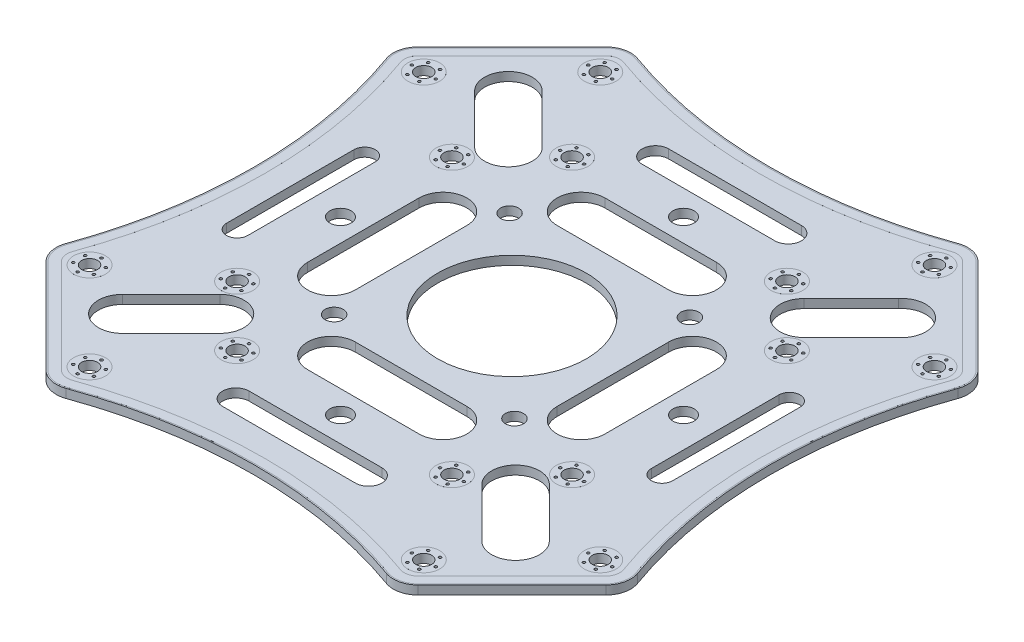
from build123d import *

# Parameters (mm, degrees)
BOSS_EXTRUDE1_DEPTH      = 0.825
BOSS_EXTRUDE1_DEPTH_BACK = 0.825
SKETCH2_R                = 14
CUT_EXTRUDE1_DEPTH       = 1.65
SKETCH3_R                = 1.5
SKETCH3_R_2              = 2
SKETCH3_R_3              = 1.7
CUT_EXTRUDE2_DEPTH       = 1.65
BOSS_EXTRUDE2_START      = 0.001
SKETCH4_R                = 3
SKETCH4_R_2              = 1.5
SKETCH4_R_3              = 0.25
BOSS_EXTRUDE2_DEPTH      = 0.001
SKETCH5_R                = 0.25
CUT_EXTRUDE3_DEPTH       = 1.65


with BuildPart() as part:
    # Sketch1 → Boss-Extrude1 (new, two sides: drawn at the far end of the back side and taken through both)
    with BuildSketch(Plane(origin=(0, 0, 0), x_dir=(1, 0, 0), z_dir=(0, 1, 0)).offset(-BOSS_EXTRUDE1_DEPTH_BACK)):
        with BuildLine():
            Line((35.046361717, 52.705589829), (52.705589829, 35.046361717))
            ThreePointArc((52.705589829, 35.046361717), (53.961944938, 32.762265708), (53.8, 30.160478519))
            ThreePointArc((53.8, 30.160478519), (48.55, 0), (53.8, -30.160478519))
            ThreePointArc((53.8, -30.160478519), (53.961944938, -32.762265708), (52.705589829, -35.046361717))
            Line((52.705589829, -35.046361717), (35.046361717, -52.705589829))
            ThreePointArc((35.046361717, -52.705589829), (32.762265708, -53.961944938), (30.160478519, -53.8))
            ThreePointArc((30.160478519, -53.8), (0, -48.55), (-30.160478519, -53.8))
            ThreePointArc((-30.160478519, -53.8), (-32.762265708, -53.961944938), (-35.046361717, -52.705589829))
            Line((-35.046361717, -52.705589829), (-52.705589829, -35.046361717))
            ThreePointArc((-52.705589829, -35.046361717), (-53.961944938, -32.762265708), (-53.8, -30.160478519))
            ThreePointArc((-53.8, -30.160478519), (-48.55, 0), (-53.8, 30.160478519))
            ThreePointArc((-53.8, 30.160478519), (-53.961944938, 32.762265708), (-52.705589829, 35.046361717))
            Line((-52.705589829, 35.046361717), (-35.046361717, 52.705589829))
            ThreePointArc((-35.046361717, 52.705589829), (-32.762265708, 53.961944938), (-30.160478519, 53.8))
            ThreePointArc((-30.160478519, 53.8), (0, 48.55), (30.160478519, 53.8))
            ThreePointArc((30.160478519, 53.8), (32.762265708, 53.961944938), (35.046361717, 52.705589829))
        make_face()
    extrude(amount=BOSS_EXTRUDE1_DEPTH + BOSS_EXTRUDE1_DEPTH_BACK)

    # Sketch2 → Cut-Extrude1 (cut)
    with BuildSketch(Plane(origin=(0, 0.825, 0), x_dir=(1, 0, 0), z_dir=(0, 1, 0))):
        with Locations(Location((0, 0, 0), (0, 0, 270))):
            Circle(SKETCH2_R)
        with BuildLine():
            Line((-12.5, -42), (12.5, -42))
            ThreePointArc((12.5, -42), (15, -39.5), (12.5, -37))
            Line((12.5, -37), (-12.5, -37))
            ThreePointArc((-12.5, -37), (-15, -39.5), (-12.5, -42))
        make_face()
        with BuildLine():
            Line((-10.5, -28), (10.5, -28))
            ThreePointArc((10.5, -28), (15, -23.5), (10.5, -19))
            Line((10.5, -19), (-10.5, -19))
            ThreePointArc((-10.5, -19), (-15, -23.5), (-10.5, -28))
        make_face()
        with BuildLine():
            Line((28, -10.5), (28, 10.5))
            ThreePointArc((28, 10.5), (23.5, 15), (19, 10.5))
            Line((19, 10.5), (19, -10.5))
            ThreePointArc((19, -10.5), (23.5, -15), (28, -10.5))
        make_face()
        with BuildLine():
            Line((38, -11.755562678), (38, 12.244437322))
            ThreePointArc((38, 12.244437322), (40, 14.244437322), (42, 12.244437322))
            Line((42, 12.244437322), (42, -11.755562678))
            ThreePointArc((42, -11.755562678), (40, -13.755562678), (38, -11.755562678))
        make_face()
        with BuildLine():
            Line((-10.5, 19), (10.5, 19))
            ThreePointArc((10.5, 19), (15, 23.5), (10.5, 28))
            Line((10.5, 28), (-10.5, 28))
            ThreePointArc((-10.5, 28), (-15, 23.5), (-10.5, 19))
        make_face()
        with BuildLine():
            Line((-12.5, 37), (12.5, 37))
            ThreePointArc((12.5, 37), (15, 39.5), (12.5, 42))
            Line((12.5, 42), (-12.5, 42))
            ThreePointArc((-12.5, 42), (-15, 39.5), (-12.5, 37))
        make_face()
        with BuildLine():
            Line((-42, -11.755562678), (-42, 12.244437322))
            ThreePointArc((-42, 12.244437322), (-40, 14.244437322), (-38, 12.244437322))
            Line((-38, 12.244437322), (-38, -11.755562678))
            ThreePointArc((-38, -11.755562678), (-40, -13.755562678), (-42, -11.755562678))
        make_face()
        with BuildLine():
            Line((-19, 10.5), (-19, -10.5))
            ThreePointArc((-19, -10.5), (-23.5, -15), (-28, -10.5))
            Line((-28, -10.5), (-28, 10.5))
            ThreePointArc((-28, 10.5), (-23.5, 15), (-19, 10.5))
        make_face()
        with BuildLine():
            Line((-33.84335844, -39.530701313), (-24.650970284, -30.338313157))
            ThreePointArc((-24.650970284, -30.338313157), (-24.650970284, -23.974352127), (-31.014931315, -23.974352127))
            Line((-31.014931315, -23.974352127), (-40.207319471, -33.166740282))
            ThreePointArc((-40.207319471, -33.166740282), (-40.207319471, -39.530701313), (-33.84335844, -39.530701313))
        make_face()
        with BuildLine():
            Line((24.653968827, -30.341308877), (33.683172116, -39.362011494))
            ThreePointArc((33.683172116, -39.362011494), (40.124009841, -39.611884713), (40.207319471, -33.166740282))
            Line((40.207319471, -33.166740282), (31.014931315, -23.974352127))
            ThreePointArc((31.014931315, -23.974352127), (24.649472072, -23.975851045), (24.653968827, -30.341308877))
        make_face()
        with BuildLine():
            Line((33.545972757, 39.23331563), (24.650970284, 30.338313157))
            ThreePointArc((24.650970284, 30.338313157), (24.650970284, 23.974352127), (31.014931315, 23.974352127))
            Line((31.014931315, 23.974352127), (39.909933788, 32.869354599))
            ThreePointArc((39.909933788, 32.869354599), (40.221185986, 39.544567828), (33.545972757, 39.23331563))
        make_face()
        with BuildLine():
            Line((-40.207319471, 33.166740282), (-31.014931315, 23.974352127))
            ThreePointArc((-31.014931315, 23.974352127), (-24.650970284, 23.974352127), (-24.650970284, 30.338313157))
            Line((-24.650970284, 30.338313157), (-33.84335844, 39.530701313))
            ThreePointArc((-33.84335844, 39.530701313), (-40.207319471, 39.530701313), (-40.207319471, 33.166740282))
        make_face()
    extrude(amount=-CUT_EXTRUDE1_DEPTH, mode=Mode.SUBTRACT)

    # Sketch3 → Cut-Extrude2 (cut)
    with BuildSketch(Plane(origin=(0, 0.825, 0), x_dir=(1, 0, 0), z_dir=(0, 1, 0))):
        with Locations(Location((-48.083261121, -31.466251763, 0), (0, 0, 270))):
            Circle(SKETCH3_R)
        with Locations(Location((-31.466251763, -48.083261121, 0), (0, 0, 270))):
            Circle(SKETCH3_R)
        with Locations(Location((31.466251763, -48.083261121, 0), (0, 0, 270))):
            Circle(SKETCH3_R)
        with Locations(Location((48.083261121, -31.466251763, 0), (0, 0, 270))):
            Circle(SKETCH3_R)
        with Locations(Location((48.083261121, 31.466251763, 0), (0, 0, 270))):
            Circle(SKETCH3_R)
        with Locations(Location((31.466251763, 48.083261121, 0), (0, 0, 270))):
            Circle(SKETCH3_R)
        with Locations(Location((-31.466251763, 48.083261121, 0), (0, 0, 270))):
            Circle(SKETCH3_R)
        with Locations(Location((-48.083261121, 31.466251763, 0), (0, 0, 270))):
            Circle(SKETCH3_R)
        with Locations(Location((-31.540291459, -20.22658296, 0), (0, 0, 270))):
            Circle(SKETCH3_R)
        with Locations(Location((-20.22658296, -31.540291459, 0), (0, 0, 270))):
            Circle(SKETCH3_R)
        with Locations(Location((-31.540291459, 20.22658296, 0), (0, 0, 270))):
            Circle(SKETCH3_R)
        with Locations(Location((-20.22658296, 31.540291459, 0), (0, 0, 270))):
            Circle(SKETCH3_R)
        with Locations(Location((20.22658296, 31.540291459, 0), (0, 0, 270))):
            Circle(SKETCH3_R)
        with Locations(Location((31.540291459, 20.22658296, 0), (0, 0, 270))):
            Circle(SKETCH3_R)
        with Locations(Location((31.540291459, -20.22658296, 0), (0, 0, 270))):
            Circle(SKETCH3_R)
        with Locations(Location((20.22658296, -31.540291459, 0), (0, 0, 270))):
            Circle(SKETCH3_R)
        with Locations(Location((0, -32.3, 0), (0, 0, 270))):
            Circle(SKETCH3_R_2)
        with Locations(Location((-32.3, 0, 0), (0, 0, 270))):
            Circle(SKETCH3_R_2)
        with Locations(Location((32.3, 0, 0), (0, 0, 270))):
            Circle(SKETCH3_R_2)
        with Locations(Location((0, 32.3, 0), (0, 0, 270))):
            Circle(SKETCH3_R_2)
        with Locations(Location((-16.980389316, 16.514312743, 0), (0, 0, 270))):
            Circle(SKETCH3_R_3)
        with Locations(Location((16.980389316, 16.514312743, 0), (0, 0, 270))):
            Circle(SKETCH3_R_3)
        with Locations(Location((-16.980389316, -16.514312743, 0), (0, 0, 270))):
            Circle(SKETCH3_R_3)
        with Locations(Location((16.979350847, -16.515338972, 0), (0, 0, 270))):
            Circle(SKETCH3_R_3)
    extrude(amount=-CUT_EXTRUDE2_DEPTH, mode=Mode.SUBTRACT)

    # Sketch4 → Boss-Extrude2 (add)
    # profile 1 of 17: a face of its own
    with BuildSketch(Plane(origin=(0, 0.825, 0), x_dir=(1, 0, 0), z_dir=(0, 1, 0)).offset(BOSS_EXTRUDE2_START)):
        with BuildLine():
            Line((34.869585021, -52.528813133), (52.528813133, -34.869585021))
            ThreePointArc((52.528813133, -34.869585021), (53.71799007, -32.707621199), (53.564704439, -30.244953362))
            ThreePointArc((53.564704439, -30.244953362), (48.3, 0), (53.564704439, 30.244953362))
            ThreePointArc((53.564704439, 30.244953362), (53.71799007, 32.707621199), (52.528813133, 34.869585021))
            Line((52.528813133, 34.869585021), (34.869585021, 52.528813133))
            ThreePointArc((34.869585021, 52.528813133), (32.707621199, 53.71799007), (30.244953362, 53.564704439))
            ThreePointArc((30.244953362, 53.564704439), (0, 48.3), (-30.244953362, 53.564704439))
            ThreePointArc((-30.244953362, 53.564704439), (-32.707621199, 53.71799007), (-34.869585021, 52.528813133))
            Line((-34.869585021, 52.528813133), (-52.528813133, 34.869585021))
            ThreePointArc((-52.528813133, 34.869585021), (-53.71799007, 32.707621199), (-53.564704439, 30.244953362))
            ThreePointArc((-53.564704439, 30.244953362), (-48.3, 0), (-53.564704439, -30.244953362))
            ThreePointArc((-53.564704439, -30.244953362), (-53.71799007, -32.707621199), (-52.528813133, -34.869585021))
            Line((-52.528813133, -34.869585021), (-34.869585021, -52.528813133))
            ThreePointArc((-34.869585021, -52.528813133), (-32.707621199, -53.71799007), (-30.244953362, -53.564704439))
            ThreePointArc((-30.244953362, -53.564704439), (0, -48.3), (30.244953362, -53.564704439))
            ThreePointArc((30.244953362, -53.564704439), (32.707621199, -53.71799007), (34.869585021, -52.528813133))
        make_face()
        with BuildLine():
            Line((-51.256020927, 33.596792815), (-33.596792815, 51.256020927))
            ThreePointArc((-33.596792815, 51.256020927), (-32.314180733, 51.961515021), (-30.853172233, 51.870576403))
            ThreePointArc((-30.853172233, 51.870576403), (0, 46.5), (30.853172233, 51.870576403))
            ThreePointArc((30.853172233, 51.870576403), (32.314180733, 51.961515021), (33.596792815, 51.256020927))
            Line((33.596792815, 51.256020927), (51.256020927, 33.596792815))
            ThreePointArc((51.256020927, 33.596792815), (51.961515021, 32.314180733), (51.870576403, 30.853172233))
            ThreePointArc((51.870576403, 30.853172233), (46.5, 0), (51.870576403, -30.853172233))
            ThreePointArc((51.870576403, -30.853172233), (51.961515021, -32.314180733), (51.256020927, -33.596792815))
            Line((51.256020927, -33.596792815), (33.596792815, -51.256020927))
            ThreePointArc((33.596792815, -51.256020927), (32.314180733, -51.961515021), (30.853172233, -51.870576403))
            ThreePointArc((30.853172233, -51.870576403), (0, -46.5), (-30.853172233, -51.870576403))
            ThreePointArc((-30.853172233, -51.870576403), (-32.314180733, -51.961515021), (-33.596792815, -51.256020927))
            Line((-33.596792815, -51.256020927), (-51.256020927, -33.596792815))
            ThreePointArc((-51.256020927, -33.596792815), (-51.961515021, -32.314180733), (-51.870576403, -30.853172233))
            ThreePointArc((-51.870576403, -30.853172233), (-46.5, 0), (-51.870576403, 30.853172233))
            ThreePointArc((-51.870576403, 30.853172233), (-51.961515021, 32.314180733), (-51.256020927, 33.596792815))
        make_face(mode=Mode.SUBTRACT)
    # profile 2 of 17: a face of its own
    with BuildSketch(Plane(origin=(0, 0.825, 0), x_dir=(1, 0, 0), z_dir=(0, 1, 0)).offset(BOSS_EXTRUDE2_START)):
        with Locations(Location((31.466251763, -48.083261121, 0), (0, 0, 270))):
            Circle(SKETCH4_R)
        with Locations(Location((31.466251763, -48.083261121, 0), (0, 0, 270))):
            Circle(SKETCH4_R_2, mode=Mode.SUBTRACT)
        with Locations(Location((30.341251763, -50.031818279, 0), (0, 0, 270))):
            Circle(SKETCH4_R_3, mode=Mode.SUBTRACT)
        with Locations(Location((29.216251763, -48.083261121, 0), (0, 0, 270))):
            Circle(SKETCH4_R_3, mode=Mode.SUBTRACT)
        with Locations(Location((30.341251763, -46.134703962, 0), (0, 0, 270))):
            Circle(SKETCH4_R_3, mode=Mode.SUBTRACT)
        with Locations(Location((32.591251763, -46.134703962, 0), (0, 0, 270))):
            Circle(SKETCH4_R_3, mode=Mode.SUBTRACT)
        with Locations(Location((33.716251763, -48.083261121, 0), (0, 0, 270))):
            Circle(SKETCH4_R_3, mode=Mode.SUBTRACT)
        with Locations(Location((32.591251763, -50.031818279, 0), (0, 0, 270))):
            Circle(SKETCH4_R_3, mode=Mode.SUBTRACT)
    # profile 3 of 17: a face of its own
    with BuildSketch(Plane(origin=(0, 0.825, 0), x_dir=(1, 0, 0), z_dir=(0, 1, 0)).offset(BOSS_EXTRUDE2_START)):
        with Locations(Location((48.083261121, -31.466251763, 0), (0, 0, 270))):
            Circle(SKETCH4_R)
        with Locations(Location((48.083261121, -31.466251763, 0), (0, 0, 270))):
            Circle(SKETCH4_R_2, mode=Mode.SUBTRACT)
        with Locations(Location((46.958261121, -33.414808921, 0), (0, 0, 270))):
            Circle(SKETCH4_R_3, mode=Mode.SUBTRACT)
        with Locations(Location((45.833261121, -31.466251763, 0), (0, 0, 270))):
            Circle(SKETCH4_R_3, mode=Mode.SUBTRACT)
        with Locations(Location((46.958261121, -29.517694604, 0), (0, 0, 270))):
            Circle(SKETCH4_R_3, mode=Mode.SUBTRACT)
        with Locations(Location((49.208261121, -29.517694604, 0), (0, 0, 270))):
            Circle(SKETCH4_R_3, mode=Mode.SUBTRACT)
        with Locations(Location((50.333261121, -31.466251763, 0), (0, 0, 270))):
            Circle(SKETCH4_R_3, mode=Mode.SUBTRACT)
        with Locations(Location((49.208261121, -33.414808921, 0), (0, 0, 270))):
            Circle(SKETCH4_R_3, mode=Mode.SUBTRACT)
    # profile 4 of 17: a face of its own
    with BuildSketch(Plane(origin=(0, 0.825, 0), x_dir=(1, 0, 0), z_dir=(0, 1, 0)).offset(BOSS_EXTRUDE2_START)):
        with Locations(Location((31.540291459, -20.22658296, 0), (0, 0, 270))):
            Circle(SKETCH4_R)
        with Locations(Location((31.540291459, -20.22658296, 0), (0, 0, 270))):
            Circle(SKETCH4_R_2, mode=Mode.SUBTRACT)
        with Locations(Location((30.415291459, -22.175140119, 0), (0, 0, 270))):
            Circle(SKETCH4_R_3, mode=Mode.SUBTRACT)
        with Locations(Location((29.290291459, -20.22658296, 0), (0, 0, 270))):
            Circle(SKETCH4_R_3, mode=Mode.SUBTRACT)
        with Locations(Location((30.415291459, -18.278025802, 0), (0, 0, 270))):
            Circle(SKETCH4_R_3, mode=Mode.SUBTRACT)
        with Locations(Location((32.665291459, -18.278025802, 0), (0, 0, 270))):
            Circle(SKETCH4_R_3, mode=Mode.SUBTRACT)
        with Locations(Location((33.790291459, -20.22658296, 0), (0, 0, 270))):
            Circle(SKETCH4_R_3, mode=Mode.SUBTRACT)
        with Locations(Location((32.665291459, -22.175140119, 0), (0, 0, 270))):
            Circle(SKETCH4_R_3, mode=Mode.SUBTRACT)
    # profile 5 of 17: a face of its own
    with BuildSketch(Plane(origin=(0, 0.825, 0), x_dir=(1, 0, 0), z_dir=(0, 1, 0)).offset(BOSS_EXTRUDE2_START)):
        with Locations(Location((20.22658296, -31.540291459, 0), (0, 0, 270))):
            Circle(SKETCH4_R)
        with Locations(Location((20.22658296, -31.540291459, 0), (0, 0, 270))):
            Circle(SKETCH4_R_2, mode=Mode.SUBTRACT)
        with Locations(Location((19.10158296, -33.488848618, 0), (0, 0, 270))):
            Circle(SKETCH4_R_3, mode=Mode.SUBTRACT)
        with Locations(Location((21.35158296, -33.488848618, 0), (0, 0, 270))):
            Circle(SKETCH4_R_3, mode=Mode.SUBTRACT)
        with Locations(Location((22.47658296, -31.540291459, 0), (0, 0, 270))):
            Circle(SKETCH4_R_3, mode=Mode.SUBTRACT)
        with Locations(Location((21.35158296, -29.591734301, 0), (0, 0, 270))):
            Circle(SKETCH4_R_3, mode=Mode.SUBTRACT)
        with Locations(Location((19.10158296, -29.591734301, 0), (0, 0, 270))):
            Circle(SKETCH4_R_3, mode=Mode.SUBTRACT)
        with Locations(Location((17.97658296, -31.540291459, 0), (0, 0, 270))):
            Circle(SKETCH4_R_3, mode=Mode.SUBTRACT)
    # profile 6 of 17: a face of its own
    with BuildSketch(Plane(origin=(0, 0.825, 0), x_dir=(1, 0, 0), z_dir=(0, 1, 0)).offset(BOSS_EXTRUDE2_START)):
        with Locations(Location((31.540291459, 20.22658296, 0), (0, 0, 270))):
            Circle(SKETCH4_R)
        with Locations(Location((31.540291459, 20.22658296, 0), (0, 0, 270))):
            Circle(SKETCH4_R_2, mode=Mode.SUBTRACT)
        with Locations(Location((29.591734301, 21.35158296, 0), (0, 0, 270))):
            Circle(SKETCH4_R_3, mode=Mode.SUBTRACT)
        with Locations(Location((29.591734301, 19.10158296, 0), (0, 0, 270))):
            Circle(SKETCH4_R_3, mode=Mode.SUBTRACT)
        with Locations(Location((31.540291459, 17.97658296, 0), (0, 0, 270))):
            Circle(SKETCH4_R_3, mode=Mode.SUBTRACT)
        with Locations(Location((33.488848618, 19.10158296, 0), (0, 0, 270))):
            Circle(SKETCH4_R_3, mode=Mode.SUBTRACT)
        with Locations(Location((33.488848618, 21.35158296, 0), (0, 0, 270))):
            Circle(SKETCH4_R_3, mode=Mode.SUBTRACT)
        with Locations(Location((31.540291459, 22.47658296, 0), (0, 0, 270))):
            Circle(SKETCH4_R_3, mode=Mode.SUBTRACT)
    # profile 7 of 17: a face of its own
    with BuildSketch(Plane(origin=(0, 0.825, 0), x_dir=(1, 0, 0), z_dir=(0, 1, 0)).offset(BOSS_EXTRUDE2_START)):
        with Locations(Location((48.083261121, 31.466251763, 0), (0, 0, 270))):
            Circle(SKETCH4_R)
        with Locations(Location((48.083261121, 31.466251763, 0), (0, 0, 270))):
            Circle(SKETCH4_R_2, mode=Mode.SUBTRACT)
        with Locations(Location((48.083261121, 29.216251763, 0), (0, 0, 270))):
            Circle(SKETCH4_R_3, mode=Mode.SUBTRACT)
        with Locations(Location((46.134703962, 30.341251763, 0), (0, 0, 270))):
            Circle(SKETCH4_R_3, mode=Mode.SUBTRACT)
        with Locations(Location((50.031818279, 30.341251763, 0), (0, 0, 270))):
            Circle(SKETCH4_R_3, mode=Mode.SUBTRACT)
        with Locations(Location((50.031818279, 32.591251763, 0), (0, 0, 270))):
            Circle(SKETCH4_R_3, mode=Mode.SUBTRACT)
        with Locations(Location((48.083261121, 33.716251763, 0), (0, 0, 270))):
            Circle(SKETCH4_R_3, mode=Mode.SUBTRACT)
        with Locations(Location((46.134703962, 32.591251763, 0), (0, 0, 270))):
            Circle(SKETCH4_R_3, mode=Mode.SUBTRACT)
    # profile 8 of 17: a face of its own
    with BuildSketch(Plane(origin=(0, 0.825, 0), x_dir=(1, 0, 0), z_dir=(0, 1, 0)).offset(BOSS_EXTRUDE2_START)):
        with Locations(Location((31.466251763, 48.083261121, 0), (0, 0, 270))):
            Circle(SKETCH4_R)
        with Locations(Location((31.466251763, 48.083261121, 0), (0, 0, 270))):
            Circle(SKETCH4_R_2, mode=Mode.SUBTRACT)
        with Locations(Location((31.466251763, 45.833261121, 0), (0, 0, 270))):
            Circle(SKETCH4_R_3, mode=Mode.SUBTRACT)
        with Locations(Location((29.517694604, 46.958261121, 0), (0, 0, 270))):
            Circle(SKETCH4_R_3, mode=Mode.SUBTRACT)
        with Locations(Location((29.517694604, 49.208261121, 0), (0, 0, 270))):
            Circle(SKETCH4_R_3, mode=Mode.SUBTRACT)
        with Locations(Location((31.466251763, 50.333261121, 0), (0, 0, 270))):
            Circle(SKETCH4_R_3, mode=Mode.SUBTRACT)
        with Locations(Location((33.414808921, 49.208261121, 0), (0, 0, 270))):
            Circle(SKETCH4_R_3, mode=Mode.SUBTRACT)
        with Locations(Location((33.414808921, 46.958261121, 0), (0, 0, 270))):
            Circle(SKETCH4_R_3, mode=Mode.SUBTRACT)
    # profile 9 of 17: a face of its own
    with BuildSketch(Plane(origin=(0, 0.825, 0), x_dir=(1, 0, 0), z_dir=(0, 1, 0)).offset(BOSS_EXTRUDE2_START)):
        with Locations(Location((20.22658296, 31.540291459, 0), (0, 0, 270))):
            Circle(SKETCH4_R)
        with Locations(Location((20.22658296, 31.540291459, 0), (0, 0, 270))):
            Circle(SKETCH4_R_2, mode=Mode.SUBTRACT)
        with Locations(Location((20.22658296, 29.290291459, 0), (0, 0, 270))):
            Circle(SKETCH4_R_3, mode=Mode.SUBTRACT)
        with Locations(Location((22.175140119, 30.415291459, 0), (0, 0, 270))):
            Circle(SKETCH4_R_3, mode=Mode.SUBTRACT)
        with Locations(Location((22.175140119, 32.665291459, 0), (0, 0, 270))):
            Circle(SKETCH4_R_3, mode=Mode.SUBTRACT)
        with Locations(Location((18.278025802, 30.415291459, 0), (0, 0, 270))):
            Circle(SKETCH4_R_3, mode=Mode.SUBTRACT)
        with Locations(Location((18.278025802, 32.665291459, 0), (0, 0, 270))):
            Circle(SKETCH4_R_3, mode=Mode.SUBTRACT)
        with Locations(Location((20.22658296, 33.790291459, 0), (0, 0, 270))):
            Circle(SKETCH4_R_3, mode=Mode.SUBTRACT)
    # profile 10 of 17: a face of its own
    with BuildSketch(Plane(origin=(0, 0.825, 0), x_dir=(1, 0, 0), z_dir=(0, 1, 0)).offset(BOSS_EXTRUDE2_START)):
        with Locations(Location((-31.466251763, 48.083261121, 0), (0, 0, 270))):
            Circle(SKETCH4_R)
        with Locations(Location((-31.466251763, 48.083261121, 0), (0, 0, 270))):
            Circle(SKETCH4_R_2, mode=Mode.SUBTRACT)
        with Locations(Location((-32.591251763, 46.134703962, 0), (0, 0, 270))):
            Circle(SKETCH4_R_3, mode=Mode.SUBTRACT)
        with Locations(Location((-33.716251763, 48.083261121, 0), (0, 0, 270))):
            Circle(SKETCH4_R_3, mode=Mode.SUBTRACT)
        with Locations(Location((-32.591251763, 50.031818279, 0), (0, 0, 270))):
            Circle(SKETCH4_R_3, mode=Mode.SUBTRACT)
        with Locations(Location((-30.341251763, 50.031818279, 0), (0, 0, 270))):
            Circle(SKETCH4_R_3, mode=Mode.SUBTRACT)
        with Locations(Location((-29.216251763, 48.083261121, 0), (0, 0, 270))):
            Circle(SKETCH4_R_3, mode=Mode.SUBTRACT)
        with Locations(Location((-30.341251763, 46.134703962, 0), (0, 0, 270))):
            Circle(SKETCH4_R_3, mode=Mode.SUBTRACT)
    # profile 11 of 17: a face of its own
    with BuildSketch(Plane(origin=(0, 0.825, 0), x_dir=(1, 0, 0), z_dir=(0, 1, 0)).offset(BOSS_EXTRUDE2_START)):
        with Locations(Location((-20.22658296, 31.540291459, 0), (0, 0, 270))):
            Circle(SKETCH4_R)
        with Locations(Location((-20.22658296, 31.540291459, 0), (0, 0, 270))):
            Circle(SKETCH4_R_2, mode=Mode.SUBTRACT)
        with Locations(Location((-19.10158296, 29.591734301, 0), (0, 0, 270))):
            Circle(SKETCH4_R_3, mode=Mode.SUBTRACT)
        with Locations(Location((-21.35158296, 29.591734301, 0), (0, 0, 270))):
            Circle(SKETCH4_R_3, mode=Mode.SUBTRACT)
        with Locations(Location((-22.47658296, 31.540291459, 0), (0, 0, 270))):
            Circle(SKETCH4_R_3, mode=Mode.SUBTRACT)
        with Locations(Location((-21.35158296, 33.488848618, 0), (0, 0, 270))):
            Circle(SKETCH4_R_3, mode=Mode.SUBTRACT)
        with Locations(Location((-19.10158296, 33.488848618, 0), (0, 0, 270))):
            Circle(SKETCH4_R_3, mode=Mode.SUBTRACT)
        with Locations(Location((-17.97658296, 31.540291459, 0), (0, 0, 270))):
            Circle(SKETCH4_R_3, mode=Mode.SUBTRACT)
    # profile 12 of 17: a face of its own
    with BuildSketch(Plane(origin=(0, 0.825, 0), x_dir=(1, 0, 0), z_dir=(0, 1, 0)).offset(BOSS_EXTRUDE2_START)):
        with Locations(Location((-31.540291459, 20.22658296, 0), (0, 0, 270))):
            Circle(SKETCH4_R)
        with Locations(Location((-31.540291459, 20.22658296, 0), (0, 0, 270))):
            Circle(SKETCH4_R_2, mode=Mode.SUBTRACT)
        with Locations(Location((-32.665291459, 18.278025802, 0), (0, 0, 270))):
            Circle(SKETCH4_R_3, mode=Mode.SUBTRACT)
        with Locations(Location((-33.790291459, 20.22658296, 0), (0, 0, 270))):
            Circle(SKETCH4_R_3, mode=Mode.SUBTRACT)
        with Locations(Location((-32.665291459, 22.175140119, 0), (0, 0, 270))):
            Circle(SKETCH4_R_3, mode=Mode.SUBTRACT)
        with Locations(Location((-30.415291459, 22.175140119, 0), (0, 0, 270))):
            Circle(SKETCH4_R_3, mode=Mode.SUBTRACT)
        with Locations(Location((-29.290291459, 20.22658296, 0), (0, 0, 270))):
            Circle(SKETCH4_R_3, mode=Mode.SUBTRACT)
        with Locations(Location((-30.415291459, 18.278025802, 0), (0, 0, 270))):
            Circle(SKETCH4_R_3, mode=Mode.SUBTRACT)
    # profile 13 of 17: a face of its own
    with BuildSketch(Plane(origin=(0, 0.825, 0), x_dir=(1, 0, 0), z_dir=(0, 1, 0)).offset(BOSS_EXTRUDE2_START)):
        with Locations(Location((-48.083261121, 31.466251763, 0), (0, 0, 270))):
            Circle(SKETCH4_R)
        with Locations(Location((-48.083261121, 31.466251763, 0), (0, 0, 270))):
            Circle(SKETCH4_R_2, mode=Mode.SUBTRACT)
        with Locations(Location((-46.958261121, 29.517694604, 0), (0, 0, 270))):
            Circle(SKETCH4_R_3, mode=Mode.SUBTRACT)
        with Locations(Location((-45.833261121, 31.466251763, 0), (0, 0, 270))):
            Circle(SKETCH4_R_3, mode=Mode.SUBTRACT)
        with Locations(Location((-46.958261121, 33.414808921, 0), (0, 0, 270))):
            Circle(SKETCH4_R_3, mode=Mode.SUBTRACT)
        with Locations(Location((-49.208261121, 33.414808921, 0), (0, 0, 270))):
            Circle(SKETCH4_R_3, mode=Mode.SUBTRACT)
        with Locations(Location((-50.333261121, 31.466251763, 0), (0, 0, 270))):
            Circle(SKETCH4_R_3, mode=Mode.SUBTRACT)
        with Locations(Location((-49.208261121, 29.517694604, 0), (0, 0, 270))):
            Circle(SKETCH4_R_3, mode=Mode.SUBTRACT)
    # profile 14 of 17: a face of its own
    with BuildSketch(Plane(origin=(0, 0.825, 0), x_dir=(1, 0, 0), z_dir=(0, 1, 0)).offset(BOSS_EXTRUDE2_START)):
        with Locations(Location((-20.22658296, -31.540291459, 0), (0, 0, 270))):
            Circle(SKETCH4_R)
        with Locations(Location((-20.22658296, -31.540291459, 0), (0, 0, 270))):
            Circle(SKETCH4_R_2, mode=Mode.SUBTRACT)
        with Locations(Location((-20.22658296, -33.790291459, 0), (0, 0, 270))):
            Circle(SKETCH4_R_3, mode=Mode.SUBTRACT)
        with Locations(Location((-18.278025802, -32.665291459, 0), (0, 0, 270))):
            Circle(SKETCH4_R_3, mode=Mode.SUBTRACT)
        with Locations(Location((-18.278025802, -30.415291459, 0), (0, 0, 270))):
            Circle(SKETCH4_R_3, mode=Mode.SUBTRACT)
        with Locations(Location((-20.22658296, -29.290291459, 0), (0, 0, 270))):
            Circle(SKETCH4_R_3, mode=Mode.SUBTRACT)
        with Locations(Location((-22.175140119, -30.415291459, 0), (0, 0, 270))):
            Circle(SKETCH4_R_3, mode=Mode.SUBTRACT)
        with Locations(Location((-22.175140119, -32.665291459, 0), (0, 0, 270))):
            Circle(SKETCH4_R_3, mode=Mode.SUBTRACT)
    # profile 15 of 17: a face of its own
    with BuildSketch(Plane(origin=(0, 0.825, 0), x_dir=(1, 0, 0), z_dir=(0, 1, 0)).offset(BOSS_EXTRUDE2_START)):
        with Locations(Location((-31.540291459, -20.22658296, 0), (0, 0, 270))):
            Circle(SKETCH4_R)
        with Locations(Location((-31.540291459, -20.22658296, 0), (0, 0, 270))):
            Circle(SKETCH4_R_2, mode=Mode.SUBTRACT)
        with Locations(Location((-31.540291459, -22.47658296, 0), (0, 0, 270))):
            Circle(SKETCH4_R_3, mode=Mode.SUBTRACT)
        with Locations(Location((-29.591734301, -21.35158296, 0), (0, 0, 270))):
            Circle(SKETCH4_R_3, mode=Mode.SUBTRACT)
        with Locations(Location((-29.591734301, -19.10158296, 0), (0, 0, 270))):
            Circle(SKETCH4_R_3, mode=Mode.SUBTRACT)
        with Locations(Location((-31.540291459, -17.97658296, 0), (0, 0, 270))):
            Circle(SKETCH4_R_3, mode=Mode.SUBTRACT)
        with Locations(Location((-33.488848618, -19.10158296, 0), (0, 0, 270))):
            Circle(SKETCH4_R_3, mode=Mode.SUBTRACT)
        with Locations(Location((-33.488848618, -21.35158296, 0), (0, 0, 270))):
            Circle(SKETCH4_R_3, mode=Mode.SUBTRACT)
    # profile 16 of 17: a face of its own
    with BuildSketch(Plane(origin=(0, 0.825, 0), x_dir=(1, 0, 0), z_dir=(0, 1, 0)).offset(BOSS_EXTRUDE2_START)):
        with Locations(Location((-48.083261121, -31.466251763, 0), (0, 0, 270))):
            Circle(SKETCH4_R)
        with Locations(Location((-48.083261121, -31.466251763, 0), (0, 0, 270))):
            Circle(SKETCH4_R_2, mode=Mode.SUBTRACT)
        with Locations(Location((-48.083261121, -33.716251763, 0), (0, 0, 270))):
            Circle(SKETCH4_R_3, mode=Mode.SUBTRACT)
        with Locations(Location((-46.134703962, -32.591251763, 0), (0, 0, 270))):
            Circle(SKETCH4_R_3, mode=Mode.SUBTRACT)
        with Locations(Location((-46.134703962, -30.341251763, 0), (0, 0, 270))):
            Circle(SKETCH4_R_3, mode=Mode.SUBTRACT)
        with Locations(Location((-48.083261121, -29.216251763, 0), (0, 0, 270))):
            Circle(SKETCH4_R_3, mode=Mode.SUBTRACT)
        with Locations(Location((-50.031818279, -30.341251763, 0), (0, 0, 270))):
            Circle(SKETCH4_R_3, mode=Mode.SUBTRACT)
        with Locations(Location((-50.031818279, -32.591251763, 0), (0, 0, 270))):
            Circle(SKETCH4_R_3, mode=Mode.SUBTRACT)
    # profile 17 of 17: a face of its own
    with BuildSketch(Plane(origin=(0, 0.825, 0), x_dir=(1, 0, 0), z_dir=(0, 1, 0)).offset(BOSS_EXTRUDE2_START)):
        with Locations(Location((-31.466251763, -48.083261121, 0), (0, 0, 270))):
            Circle(SKETCH4_R)
        with Locations(Location((-31.466251763, -48.083261121, 0), (0, 0, 270))):
            Circle(SKETCH4_R_2, mode=Mode.SUBTRACT)
        with Locations(Location((-31.466251763, -50.333261121, 0), (0, 0, 270))):
            Circle(SKETCH4_R_3, mode=Mode.SUBTRACT)
        with Locations(Location((-29.517694604, -49.208261121, 0), (0, 0, 270))):
            Circle(SKETCH4_R_3, mode=Mode.SUBTRACT)
        with Locations(Location((-29.517694604, -46.958261121, 0), (0, 0, 270))):
            Circle(SKETCH4_R_3, mode=Mode.SUBTRACT)
        with Locations(Location((-31.466251763, -45.833261121, 0), (0, 0, 270))):
            Circle(SKETCH4_R_3, mode=Mode.SUBTRACT)
        with Locations(Location((-33.414808921, -46.958261121, 0), (0, 0, 270))):
            Circle(SKETCH4_R_3, mode=Mode.SUBTRACT)
        with Locations(Location((-33.414808921, -49.208261121, 0), (0, 0, 270))):
            Circle(SKETCH4_R_3, mode=Mode.SUBTRACT)
    boss_extrude2 = extrude(amount=-BOSS_EXTRUDE2_DEPTH)

    # Mirror2: Boss-Extrude2 across plane
    add(boss_extrude2.mirror(Plane.ZX))

    # Sketch5 → Cut-Extrude3 (cut)
    with BuildSketch(Plane(origin=(0, 0.825, 0), x_dir=(1, 0, 0), z_dir=(0, 1, 0))):
        with Locations(Location((-31.466251763, -45.833261121, 0), (0, 0, 270))):
            Circle(SKETCH5_R)
        with Locations(Location((-29.517694604, -46.958261121, 0), (0, 0, 270))):
            Circle(SKETCH5_R)
        with Locations(Location((-29.517694604, -49.208261121, 0), (0, 0, 270))):
            Circle(SKETCH5_R)
        with Locations(Location((-31.466251763, -50.333261121, 0), (0, 0, 270))):
            Circle(SKETCH5_R)
        with Locations(Location((-33.414808921, -49.208261121, 0), (0, 0, 270))):
            Circle(SKETCH5_R)
        with Locations(Location((-33.414808921, -46.958261121, 0), (0, 0, 270))):
            Circle(SKETCH5_R)
        with Locations(Location((-48.083261121, -33.716251763, 0), (0, 0, 270))):
            Circle(SKETCH5_R)
        with Locations(Location((-50.031818279, -32.591251763, 0), (0, 0, 270))):
            Circle(SKETCH5_R)
        with Locations(Location((-50.031818279, -30.341251763, 0), (0, 0, 270))):
            Circle(SKETCH5_R)
        with Locations(Location((-48.083261121, -29.216251763, 0), (0, 0, 270))):
            Circle(SKETCH5_R)
        with Locations(Location((-46.134703962, -30.341251763, 0), (0, 0, 270))):
            Circle(SKETCH5_R)
        with Locations(Location((-46.134703962, -32.591251763, 0), (0, 0, 270))):
            Circle(SKETCH5_R)
        with Locations(Location((-33.488848618, -21.35158296, 0), (0, 0, 270))):
            Circle(SKETCH5_R)
        with Locations(Location((-33.488848618, -19.10158296, 0), (0, 0, 270))):
            Circle(SKETCH5_R)
        with Locations(Location((-31.540291459, -17.97658296, 0), (0, 0, 270))):
            Circle(SKETCH5_R)
        with Locations(Location((-29.591734301, -19.10158296, 0), (0, 0, 270))):
            Circle(SKETCH5_R)
        with Locations(Location((-29.591734301, -21.35158296, 0), (0, 0, 270))):
            Circle(SKETCH5_R)
        with Locations(Location((-31.540291459, -22.47658296, 0), (0, 0, 270))):
            Circle(SKETCH5_R)
        with Locations(Location((-22.175140119, -30.415291459, 0), (0, 0, 270))):
            Circle(SKETCH5_R)
        with Locations(Location((-22.175140119, -32.665291459, 0), (0, 0, 270))):
            Circle(SKETCH5_R)
        with Locations(Location((-20.22658296, -33.790291459, 0), (0, 0, 270))):
            Circle(SKETCH5_R)
        with Locations(Location((-18.278025802, -32.665291459, 0), (0, 0, 270))):
            Circle(SKETCH5_R)
        with Locations(Location((-18.278025802, -30.415291459, 0), (0, 0, 270))):
            Circle(SKETCH5_R)
        with Locations(Location((-20.22658296, -29.290291459, 0), (0, 0, 270))):
            Circle(SKETCH5_R)
        with Locations(Location((19.10158296, -33.488848618, 0), (0, 0, 270))):
            Circle(SKETCH5_R)
        with Locations(Location((17.97658296, -31.540291459, 0), (0, 0, 270))):
            Circle(SKETCH5_R)
        with Locations(Location((19.10158296, -29.591734301, 0), (0, 0, 270))):
            Circle(SKETCH5_R)
        with Locations(Location((21.35158296, -29.591734301, 0), (0, 0, 270))):
            Circle(SKETCH5_R)
        with Locations(Location((22.47658296, -31.540291459, 0), (0, 0, 270))):
            Circle(SKETCH5_R)
        with Locations(Location((21.35158296, -33.488848618, 0), (0, 0, 270))):
            Circle(SKETCH5_R)
        with Locations(Location((29.290291459, -20.22658296, 0), (0, 0, 270))):
            Circle(SKETCH5_R)
        with Locations(Location((30.415291459, -18.278025802, 0), (0, 0, 270))):
            Circle(SKETCH5_R)
        with Locations(Location((32.665291459, -18.278025802, 0), (0, 0, 270))):
            Circle(SKETCH5_R)
        with Locations(Location((30.415291459, -22.175140119, 0), (0, 0, 270))):
            Circle(SKETCH5_R)
        with Locations(Location((32.665291459, -22.175140119, 0), (0, 0, 270))):
            Circle(SKETCH5_R)
        with Locations(Location((33.790291459, -20.22658296, 0), (0, 0, 270))):
            Circle(SKETCH5_R)
        with Locations(Location((46.958261121, -29.517694604, 0), (0, 0, 270))):
            Circle(SKETCH5_R)
        with Locations(Location((49.208261121, -29.517694604, 0), (0, 0, 270))):
            Circle(SKETCH5_R)
        with Locations(Location((45.833261121, -31.466251763, 0), (0, 0, 270))):
            Circle(SKETCH5_R)
        with Locations(Location((46.958261121, -33.414808921, 0), (0, 0, 270))):
            Circle(SKETCH5_R)
        with Locations(Location((49.208261121, -33.414808921, 0), (0, 0, 270))):
            Circle(SKETCH5_R)
        with Locations(Location((50.333261121, -31.466251763, 0), (0, 0, 270))):
            Circle(SKETCH5_R)
        with Locations(Location((30.341251763, -46.134703962, 0), (0, 0, 270))):
            Circle(SKETCH5_R)
        with Locations(Location((32.591251763, -46.134703962, 0), (0, 0, 270))):
            Circle(SKETCH5_R)
        with Locations(Location((29.216251763, -48.083261121, 0), (0, 0, 270))):
            Circle(SKETCH5_R)
        with Locations(Location((30.341251763, -50.031818279, 0), (0, 0, 270))):
            Circle(SKETCH5_R)
        with Locations(Location((32.591251763, -50.031818279, 0), (0, 0, 270))):
            Circle(SKETCH5_R)
        with Locations(Location((33.716251763, -48.083261121, 0), (0, 0, 270))):
            Circle(SKETCH5_R)
        with Locations(Location((-32.665291459, 18.278025802, 0), (0, 0, 270))):
            Circle(SKETCH5_R)
        with Locations(Location((-33.790291459, 20.22658296, 0), (0, 0, 270))):
            Circle(SKETCH5_R)
        with Locations(Location((-32.665291459, 22.175140119, 0), (0, 0, 270))):
            Circle(SKETCH5_R)
        with Locations(Location((-30.415291459, 22.175140119, 0), (0, 0, 270))):
            Circle(SKETCH5_R)
        with Locations(Location((-29.290291459, 20.22658296, 0), (0, 0, 270))):
            Circle(SKETCH5_R)
        with Locations(Location((-30.415291459, 18.278025802, 0), (0, 0, 270))):
            Circle(SKETCH5_R)
        with Locations(Location((-49.208261121, 29.517694604, 0), (0, 0, 270))):
            Circle(SKETCH5_R)
        with Locations(Location((-50.333261121, 31.466251763, 0), (0, 0, 270))):
            Circle(SKETCH5_R)
        with Locations(Location((-49.208261121, 33.414808921, 0), (0, 0, 270))):
            Circle(SKETCH5_R)
        with Locations(Location((-46.958261121, 33.414808921, 0), (0, 0, 270))):
            Circle(SKETCH5_R)
        with Locations(Location((-45.833261121, 31.466251763, 0), (0, 0, 270))):
            Circle(SKETCH5_R)
        with Locations(Location((-46.958261121, 29.517694604, 0), (0, 0, 270))):
            Circle(SKETCH5_R)
        with Locations(Location((-32.591251763, 46.134703962, 0), (0, 0, 270))):
            Circle(SKETCH5_R)
        with Locations(Location((-33.716251763, 48.083261121, 0), (0, 0, 270))):
            Circle(SKETCH5_R)
        with Locations(Location((-32.591251763, 50.031818279, 0), (0, 0, 270))):
            Circle(SKETCH5_R)
        with Locations(Location((-30.341251763, 50.031818279, 0), (0, 0, 270))):
            Circle(SKETCH5_R)
        with Locations(Location((-29.216251763, 48.083261121, 0), (0, 0, 270))):
            Circle(SKETCH5_R)
        with Locations(Location((-30.341251763, 46.134703962, 0), (0, 0, 270))):
            Circle(SKETCH5_R)
        with Locations(Location((-21.35158296, 29.591734301, 0), (0, 0, 270))):
            Circle(SKETCH5_R)
        with Locations(Location((-22.47658296, 31.540291459, 0), (0, 0, 270))):
            Circle(SKETCH5_R)
        with Locations(Location((-21.35158296, 33.488848618, 0), (0, 0, 270))):
            Circle(SKETCH5_R)
        with Locations(Location((-19.10158296, 33.488848618, 0), (0, 0, 270))):
            Circle(SKETCH5_R)
        with Locations(Location((-17.97658296, 31.540291459, 0), (0, 0, 270))):
            Circle(SKETCH5_R)
        with Locations(Location((-19.10158296, 29.591734301, 0), (0, 0, 270))):
            Circle(SKETCH5_R)
        with Locations(Location((20.22658296, 29.290291459, 0), (0, 0, 270))):
            Circle(SKETCH5_R)
        with Locations(Location((18.278025802, 30.415291459, 0), (0, 0, 270))):
            Circle(SKETCH5_R)
        with Locations(Location((18.278025802, 32.665291459, 0), (0, 0, 270))):
            Circle(SKETCH5_R)
        with Locations(Location((20.22658296, 33.790291459, 0), (0, 0, 270))):
            Circle(SKETCH5_R)
        with Locations(Location((22.175140119, 32.665291459, 0), (0, 0, 270))):
            Circle(SKETCH5_R)
        with Locations(Location((22.175140119, 30.415291459, 0), (0, 0, 270))):
            Circle(SKETCH5_R)
        with Locations(Location((29.591734301, 21.35158296, 0), (0, 0, 270))):
            Circle(SKETCH5_R)
        with Locations(Location((31.540291459, 22.47658296, 0), (0, 0, 270))):
            Circle(SKETCH5_R)
        with Locations(Location((29.591734301, 19.10158296, 0), (0, 0, 270))):
            Circle(SKETCH5_R)
        with Locations(Location((31.540291459, 17.97658296, 0), (0, 0, 270))):
            Circle(SKETCH5_R)
        with Locations(Location((33.488848618, 19.10158296, 0), (0, 0, 270))):
            Circle(SKETCH5_R)
        with Locations(Location((33.488848618, 21.35158296, 0), (0, 0, 270))):
            Circle(SKETCH5_R)
        with Locations(Location((48.083261121, 29.216251763, 0), (0, 0, 270))):
            Circle(SKETCH5_R)
        with Locations(Location((50.031818279, 30.341251763, 0), (0, 0, 270))):
            Circle(SKETCH5_R)
        with Locations(Location((50.031818279, 32.591251763, 0), (0, 0, 270))):
            Circle(SKETCH5_R)
        with Locations(Location((48.083261121, 33.716251763, 0), (0, 0, 270))):
            Circle(SKETCH5_R)
        with Locations(Location((46.134703962, 32.591251763, 0), (0, 0, 270))):
            Circle(SKETCH5_R)
        with Locations(Location((46.134703962, 30.341251763, 0), (0, 0, 270))):
            Circle(SKETCH5_R)
        with Locations(Location((31.466251763, 45.833261121, 0), (0, 0, 270))):
            Circle(SKETCH5_R)
        with Locations(Location((29.517694604, 46.958261121, 0), (0, 0, 270))):
            Circle(SKETCH5_R)
        with Locations(Location((29.517694604, 49.208261121, 0), (0, 0, 270))):
            Circle(SKETCH5_R)
        with Locations(Location((31.466251763, 50.333261121, 0), (0, 0, 270))):
            Circle(SKETCH5_R)
        with Locations(Location((33.414808921, 49.208261121, 0), (0, 0, 270))):
            Circle(SKETCH5_R)
        with Locations(Location((33.414808921, 46.958261121, 0), (0, 0, 270))):
            Circle(SKETCH5_R)
    extrude(amount=-CUT_EXTRUDE3_DEPTH, mode=Mode.SUBTRACT)


solid = part.part
